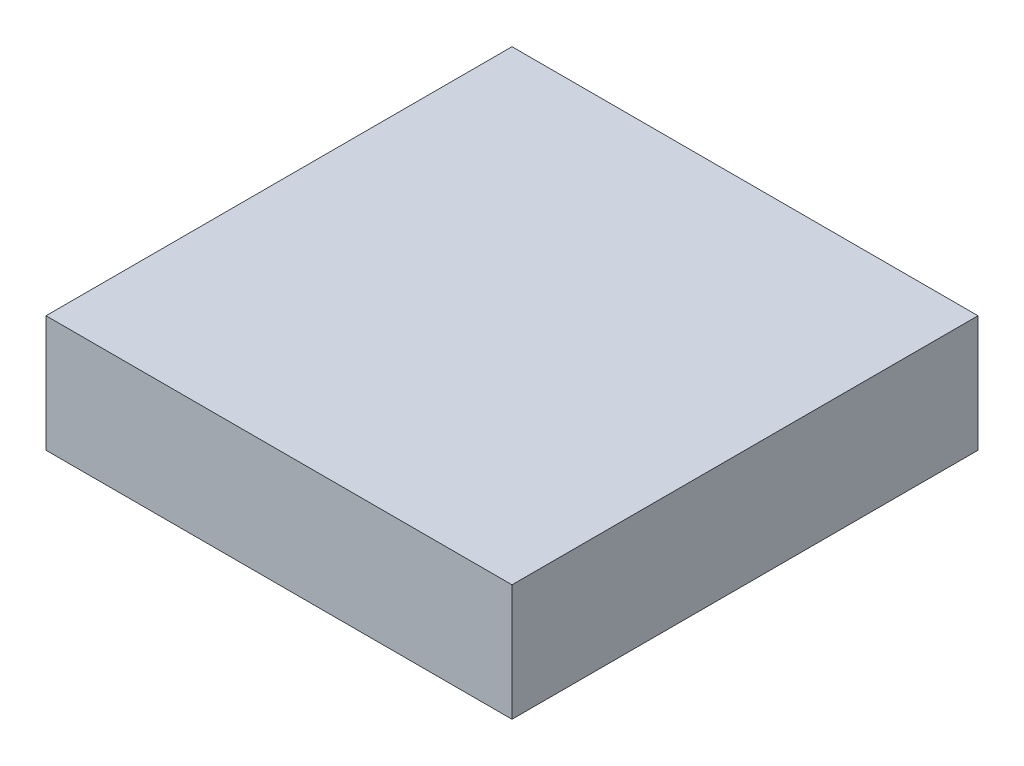
from build123d import *

# Parameters (mm, degrees)
SKETCH1_W           = 20
SKETCH1_H           = 20
BOSS_EXTRUDE1_DEPTH = 5


with BuildPart() as part:
    # Sketch1 → Boss-Extrude1 (new body)
    with BuildSketch(Plane(origin=(0, 0, 0), x_dir=(1, 0, 0), z_dir=(0, 1, 0))):
        with Locations((10, 10)):
            Rectangle(SKETCH1_W, SKETCH1_H)
    extrude(amount=BOSS_EXTRUDE1_DEPTH)


solid = part.part
